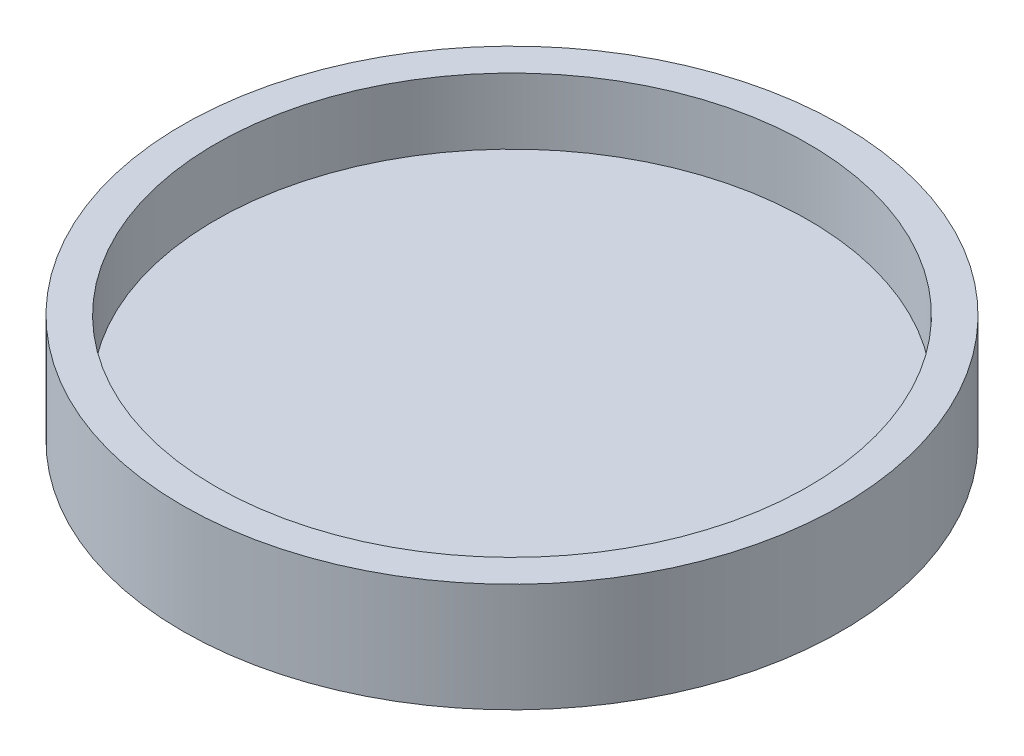
from build123d import *

# Parameters (mm, degrees)
SKETCH_1_R          = 10
EXTRUDE_1_DEPTH     = 3.3
SKETCH_2_R          = 9
CUT_EXTRUDE_1_DEPTH = 2
SKETCH_3_R          = 2.5
CUT_EXTRUDE_2_DEPTH = 0.8


with BuildPart() as part:
    # ｽｹｯﾁ1 → ﾎﾞｽ - 押し出し1 (new body)
    with BuildSketch(Plane(origin=(0, 0, 0), x_dir=(1, 0, 0), z_dir=(0, 1, 0))):
        with Locations(Location((0, 0, 0), (0, 0, 270))):
            Circle(SKETCH_1_R)
    extrude(amount=EXTRUDE_1_DEPTH)

    # ｽｹｯﾁ2 → ｶｯﾄ - 押し出し1 (cut)
    with BuildSketch(Plane(origin=(0, 3.3, 0), x_dir=(1, 0, 0), z_dir=(0, 1, 0))):
        with Locations(Location((0, 0, 0), (0, 0, 270))):
            Circle(SKETCH_2_R)
    extrude(amount=-CUT_EXTRUDE_1_DEPTH, mode=Mode.SUBTRACT)

    # ｽｹｯﾁ3 → ｶｯﾄ - 押し出し2 (cut)
    with BuildSketch(Plane.XZ):
        with Locations(Location((0, 0, 0), (0, 0, 270))):
            Circle(SKETCH_3_R)
    extrude(amount=-CUT_EXTRUDE_2_DEPTH, mode=Mode.SUBTRACT)


solid = part.part
